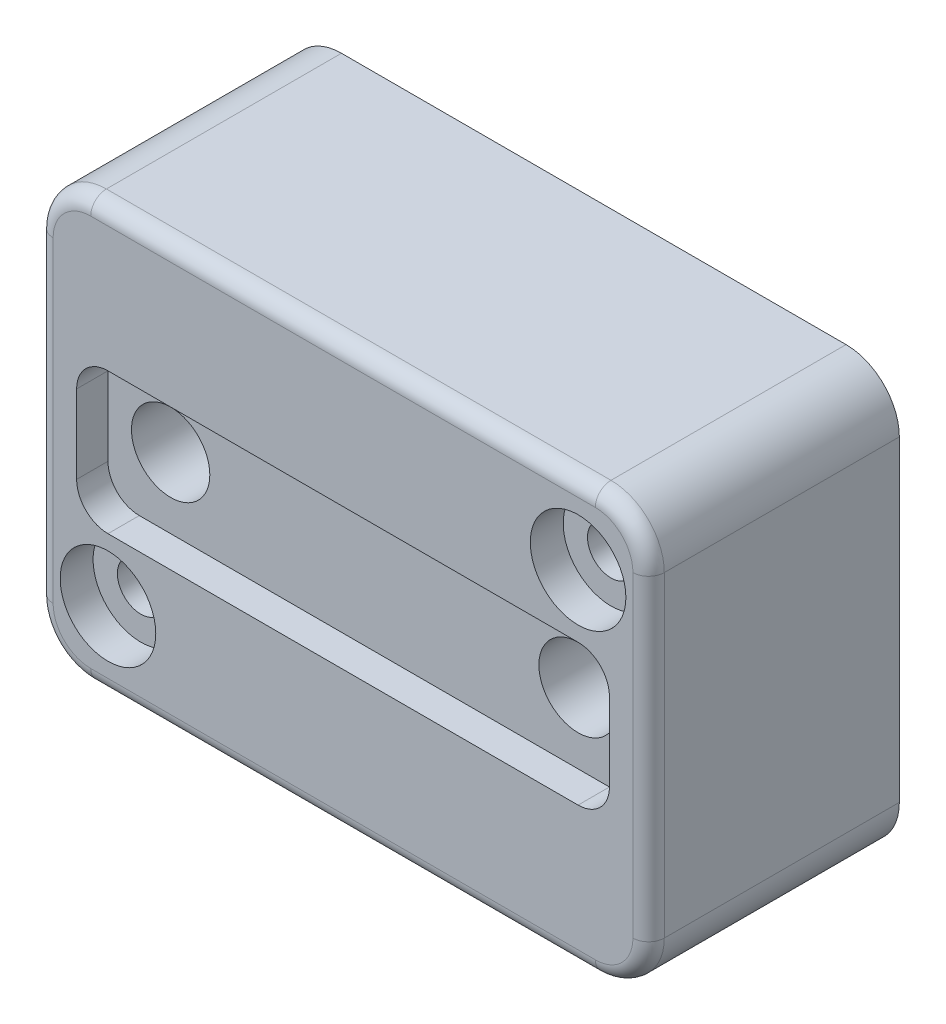
from build123d import *

# Parameters (mm, degrees)
SKIZZE1_R                       = 1.5
AUFSATZ_LINEAR_AUSTRAGEN1_DEPTH = 16
SCHNITT_LINEAR_AUSTRAGEN1_DEPTH = 2
SKIZZE3_R                       = 2.5
SCHNITT_LINEAR_AUSTRAGEN2_DEPTH = 28.540878708
SKIZZE4_R                       = 3.05
SCHNITT_LINEAR_AUSTRAGEN3_DEPTH = 2.1
VERRUNDUNG1_R                   = 1


with BuildPart() as part:
    # Skizze1 → Aufsatz-Linear austragen1 (new body)
    with BuildSketch(Plane.XY):
        with BuildLine():
            Line((-16.1, 13.5), (16.1, 13.5))
            ThreePointArc((16.1, 13.5), (18.504163056, 12.504163056), (19.5, 10.1))
            Line((19.5, 10.1), (19.5, -10.1))
            ThreePointArc((19.5, -10.1), (18.504163056, -12.504163056), (16.1, -13.5))
            Line((16.1, -13.5), (-16.1, -13.5))
            ThreePointArc((-16.1, -13.5), (-18.504163056, -12.504163056), (-19.5, -10.1))
            Line((-19.5, -10.1), (-19.5, 10.1))
            ThreePointArc((-19.5, 10.1), (-18.504163056, 12.504163056), (-16.1, 13.5))
        make_face()
        with Locations((15, 8.5)):
            Circle(SKIZZE1_R, mode=Mode.SUBTRACT)
        with Locations((-15, -8.5)):
            Circle(SKIZZE1_R, mode=Mode.SUBTRACT)
    extrude(amount=AUFSATZ_LINEAR_AUSTRAGEN1_DEPTH)

    # Skizze2 → Schnitt-Linear austragen1 (cut)
    with BuildSketch(Plane.XY.offset(16)):
        with BuildLine():
            Line((-15, 4.5), (15, 4.5))
            ThreePointArc((15, 4.5), (16.414213562, 3.914213562), (17, 2.5))
            Line((17, 2.5), (17, -2.5))
            ThreePointArc((17, -2.5), (16.414213562, -3.914213562), (15, -4.5))
            Line((15, -4.5), (-15, -4.5))
            ThreePointArc((-15, -4.5), (-16.414213562, -3.914213562), (-17, -2.5))
            Line((-17, -2.5), (-17, 2.5))
            ThreePointArc((-17, 2.5), (-16.414213562, 3.914213562), (-15, 4.5))
        make_face()
    extrude(amount=-SCHNITT_LINEAR_AUSTRAGEN1_DEPTH, mode=Mode.SUBTRACT)

    # Skizze3 → Schnitt-Linear austragen2 (cut, through all)
    with BuildSketch(Plane.XY.offset(14)):
        with Locations((-13, 0)):
            Circle(SKIZZE3_R)
        with Locations(Location((13, 0, 0), (0, 0, 180))):
            Circle(SKIZZE3_R)
    extrude(amount=-SCHNITT_LINEAR_AUSTRAGEN2_DEPTH, mode=Mode.SUBTRACT)

    # Skizze4 → Schnitt-Linear austragen3 (cut)
    with BuildSketch(Plane.XY.offset(16)):
        with Locations((15, 8.5)):
            Circle(SKIZZE4_R)
        with Locations((-15, -8.5)):
            Circle(SKIZZE4_R)
    extrude(amount=-SCHNITT_LINEAR_AUSTRAGEN3_DEPTH, mode=Mode.SUBTRACT)

    # Verrundung1
    verrundung1_edges = [part.edges().sort_by_distance(p)[0] for p in [
        (-18.504163056, 12.504163056, 16),
        (-19.5, 0, 16),
        (-18.504163056, -12.504163056, 16),
        (0, -13.5, 16),
        (18.504163056, -12.504163056, 16),
        (19.5, 0, 16),
        (18.504163056, 12.504163056, 16),
        (0, 13.5, 16),
    ]]
    fillet(verrundung1_edges, radius=VERRUNDUNG1_R)


solid = part.part
